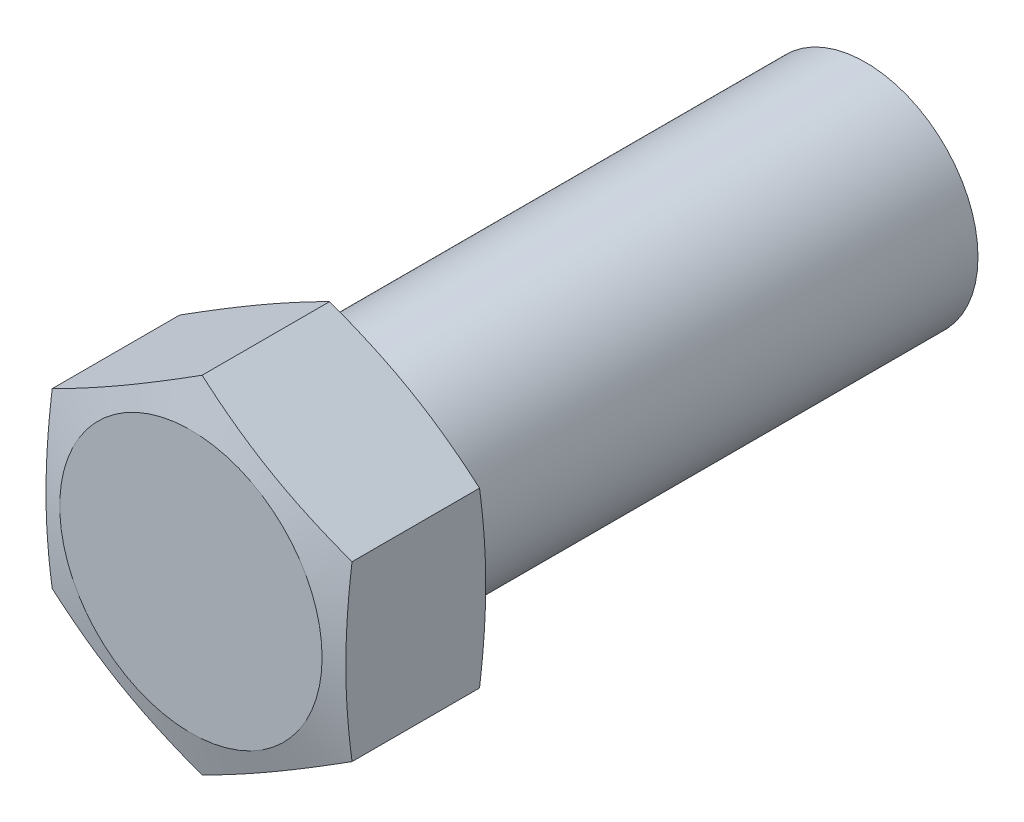
from build123d import *

# Parameters (mm, degrees)
RESSALTO_EXTRUS_O1_DEPTH = 4
ESBO_O2_OUTSIDE_W        = 124.534
ESBO_O2_OUTSIDE_H        = 125.772
ESBO_O2_OUTSIDE_R        = 3.5
CORTE_EXTRUS_O1_DEPTH    = 15
CORTE_EXTRUS_O1_DRAFT    = -75
ESBO_O3_OUTSIDE_W        = 124.534
ESBO_O3_OUTSIDE_H        = 125.772
ESBO_O3_OUTSIDE_R        = 3.5
CORTE_EXTRUS_O5_DEPTH    = 15
CORTE_EXTRUS_O5_DRAFT    = -75
ESBO_O9_R                = 3
RESSALTO_EXTRUS_O2_DEPTH = 14


with BuildPart() as part:
    # Esboço1 → Ressalto-extrusão1 (new body)
    with BuildSketch(Plane.XY):
        Polygon((0, -4.618802154), (4, -2.309401077), (4, 2.309401077), (0, 4.618802154), (-4, 2.309401077), (-4, -2.309401077), align=None)
    extrude(amount=RESSALTO_EXTRUS_O1_DEPTH)


with BuildPart() as corte_extrus_o1_tool:
    # Esboço2 outside → Corte-extrusão1 (with draft: the straight prism first)
    with BuildSketch(Plane.XY.offset(4)):
        Rectangle(ESBO_O2_OUTSIDE_W, ESBO_O2_OUTSIDE_H)
        Circle(ESBO_O2_OUTSIDE_R, mode=Mode.SUBTRACT)
    extrude(amount=-CORTE_EXTRUS_O1_DEPTH)
    # Corte-extrusão1: the draft: its side faces are tilted about the plane it starts from
    corte_extrus_o1_sides = [corte_extrus_o1_tool.faces().sort_by_distance(p)[0] for p in [
        (0, -62.886, -3.5),
        (62.267, 0, -3.5),
        (0, 62.886, -3.5),
        (-62.267, 0, -3.5),
        (-3.5, 0, -3.5),
    ]]
    draft(corte_extrus_o1_sides, Plane.XY.offset(4), CORTE_EXTRUS_O1_DRAFT)


with BuildPart() as part_1:
    add(part.part)

    # Corte-extrusão1: cut by corte_extrus_o1_tool
    add(corte_extrus_o1_tool.part, mode=Mode.SUBTRACT)


with BuildPart() as corte_extrus_o5_tool:
    # Esboço3 outside → Corte-extrusão5 (with draft: the straight prism first)
    with BuildSketch(Plane(origin=(0, 0, 0), x_dir=(-1, 0, 0), z_dir=(0, 0, -1))):
        Rectangle(ESBO_O3_OUTSIDE_W, ESBO_O3_OUTSIDE_H)
        Circle(ESBO_O3_OUTSIDE_R, mode=Mode.SUBTRACT)
    extrude(amount=-CORTE_EXTRUS_O5_DEPTH)
    # Corte-extrusão5: the draft: its side faces are tilted about the plane it starts from
    corte_extrus_o5_sides = [corte_extrus_o5_tool.faces().sort_by_distance(p)[0] for p in [
        (0, -62.886, 7.5),
        (-62.267, 0, 7.5),
        (0, 62.886, 7.5),
        (62.267, 0, 7.5),
        (3.5, 0, 7.5),
    ]]
    draft(corte_extrus_o5_sides, Plane(origin=(0, 0, 0), x_dir=(-1, 0, 0), z_dir=(0, 0, -1)), CORTE_EXTRUS_O5_DRAFT)


with BuildPart() as part_2:
    add(part_1.part)

    # Corte-extrusão5: cut by corte_extrus_o5_tool
    add(corte_extrus_o5_tool.part, mode=Mode.SUBTRACT)

    # Esboço9 → Ressalto-extrusão2 (add)
    with BuildSketch(Plane(origin=(0, 0, 0), x_dir=(-1, 0, 0), z_dir=(0, 0, -1))):
        Circle(ESBO_O9_R)
    extrude(amount=RESSALTO_EXTRUS_O2_DEPTH)


solid = part_2.part
